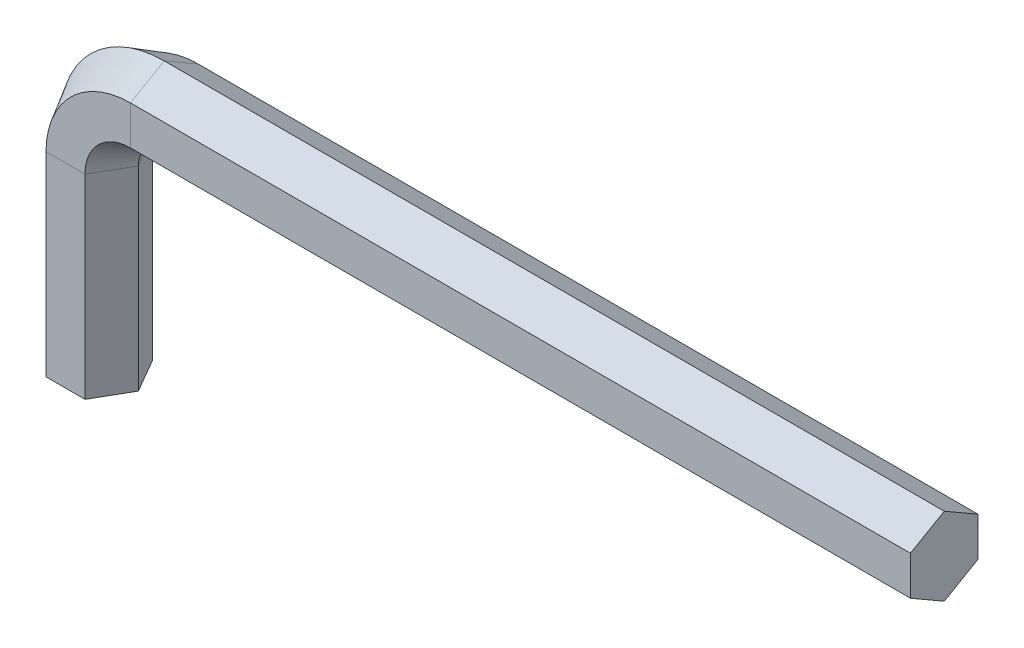
from build123d import *


with BuildPart() as part:
    # Sweep1: sweep along a path in Sketch1
    with BuildLine(Plane.XY) as sweep1_path:
        Line((0, 0), (0, 15))
        ThreePointArc((0, 15), (1.464466094, 18.535533906), (5, 20))
        Line((5, 20), (65, 20))
    # Sketch2 → Sweep1 (sweep)
    with BuildSketch(Plane(origin=(0, 0, 0), x_dir=(1, 0, 0), z_dir=(0, 1, 0))):
        Polygon((1.5, -2.598076211), (3, 0), (1.5, 2.598076211), (-1.5, 2.598076211), (-3, 0), (-1.5, -2.598076211), align=None)
    sweep(path=sweep1_path.line)


solid = part.part
